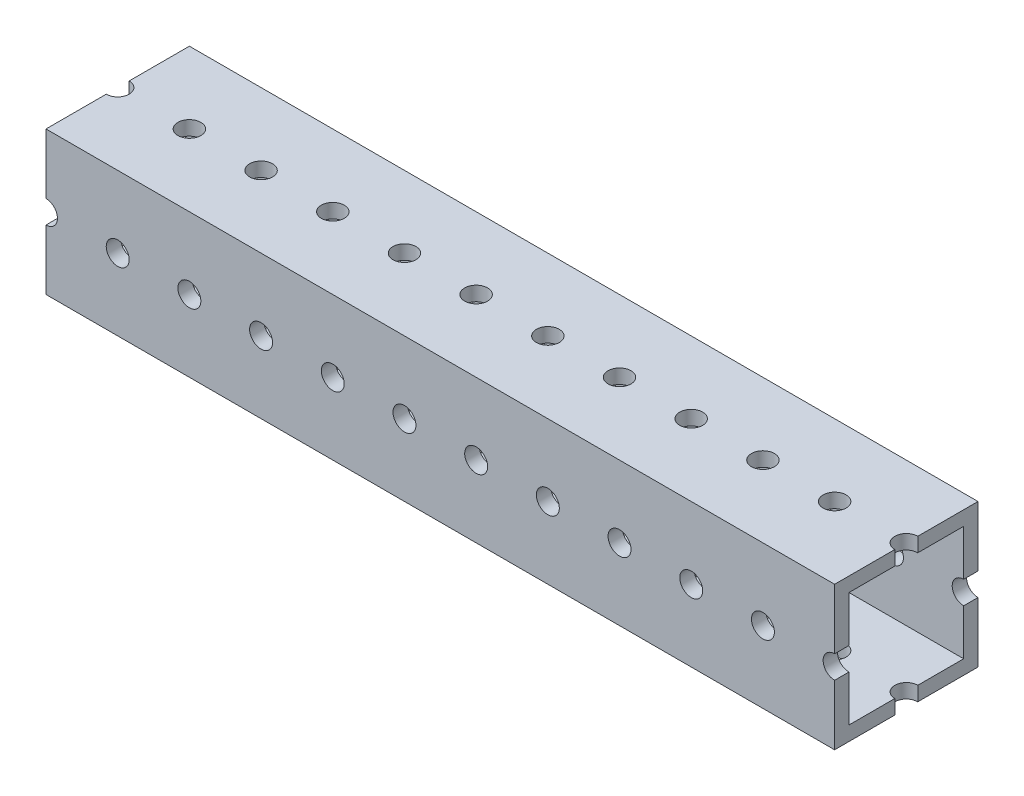
from build123d import *

# Parameters (mm, degrees)
SKETCH1_W           = 25.4
SKETCH1_H           = 25.4
SKETCH1_W_2         = 20.32
SKETCH1_H_2         = 20.32
BOSS_EXTRUDE1_DEPTH = 139.7
SKETCH2_R           = 2.032
CUT_EXTRUDE1_DEPTH  = 143.557146436
SKETCH3_R           = 2.032
CUT_EXTRUDE2_DEPTH  = 143.557146436


with BuildPart() as part:
    # Sketch1 → Boss-Extrude1 (new body)
    with BuildSketch(Plane(origin=(0, 0, 0), x_dir=(0, 0, -1), z_dir=(1, 0, 0))):
        Rectangle(SKETCH1_W, SKETCH1_H)
        Rectangle(SKETCH1_W_2, SKETCH1_H_2, mode=Mode.SUBTRACT)
    extrude(amount=BOSS_EXTRUDE1_DEPTH)

    # Sketch2 → Cut-Extrude1 (cut, through all)
    with BuildSketch(Plane(origin=(0, 12.7, 0), x_dir=(1, 0, 0), z_dir=(0, 1, 0))):
        Circle(SKETCH2_R)
        with Locations(Location((12.7, 0, 0), (0, 0, 270))):
            Circle(SKETCH2_R)
        with Locations(Location((25.4, 0, 0), (0, 0, 270))):
            Circle(SKETCH2_R)
        with Locations(Location((38.1, 0, 0), (0, 0, 270))):
            Circle(SKETCH2_R)
        with Locations(Location((50.8, 0, 0), (0, 0, 270))):
            Circle(SKETCH2_R)
        with Locations(Location((63.5, 0, 0), (0, 0, 270))):
            Circle(SKETCH2_R)
        with Locations(Location((76.2, 0, 0), (0, 0, 270))):
            Circle(SKETCH2_R)
        with Locations(Location((88.9, 0, 0), (0, 0, 270))):
            Circle(SKETCH2_R)
        with Locations(Location((101.6, 0, 0), (0, 0, 270))):
            Circle(SKETCH2_R)
        with Locations(Location((114.3, 0, 0), (0, 0, 270))):
            Circle(SKETCH2_R)
        with Locations(Location((127, 0, 0), (0, 0, 270))):
            Circle(SKETCH2_R)
        with Locations((139.7, 0)):
            Circle(SKETCH2_R)
        with Locations((152.4, 0)):
            Circle(SKETCH2_R)
        with Locations((165.1, 0)):
            Circle(SKETCH2_R)
        with Locations((177.8, 0)):
            Circle(SKETCH2_R)
        with Locations((190.5, 0)):
            Circle(SKETCH2_R)
    extrude(amount=-CUT_EXTRUDE1_DEPTH, mode=Mode.SUBTRACT)

    # Sketch3 → Cut-Extrude2 (cut, through all)
    with BuildSketch(Plane(origin=(0, 0, -12.7), x_dir=(-1, 0, 0), z_dir=(0, 0, -1))):
        Circle(SKETCH3_R)
        with Locations((-12.7, 0)):
            Circle(SKETCH3_R)
        with Locations((-25.4, 0)):
            Circle(SKETCH3_R)
        with Locations((-38.1, 0)):
            Circle(SKETCH3_R)
        with Locations((-50.8, 0)):
            Circle(SKETCH3_R)
        with Locations((-63.5, 0)):
            Circle(SKETCH3_R)
        with Locations((-76.2, 0)):
            Circle(SKETCH3_R)
        with Locations((-88.9, 0)):
            Circle(SKETCH3_R)
        with Locations((-101.6, 0)):
            Circle(SKETCH3_R)
        with Locations((-114.3, 0)):
            Circle(SKETCH3_R)
        with Locations((-127, 0)):
            Circle(SKETCH3_R)
        with Locations((-139.7, 0)):
            Circle(SKETCH3_R)
        with Locations((-152.4, 0)):
            Circle(SKETCH3_R)
        with Locations((-165.1, 0)):
            Circle(SKETCH3_R)
        with Locations((-177.8, 0)):
            Circle(SKETCH3_R)
        with Locations((-190.5, 0)):
            Circle(SKETCH3_R)
        with Locations((-203.2, 0)):
            Circle(SKETCH3_R)
    extrude(amount=-CUT_EXTRUDE2_DEPTH, mode=Mode.SUBTRACT)


solid = part.part
